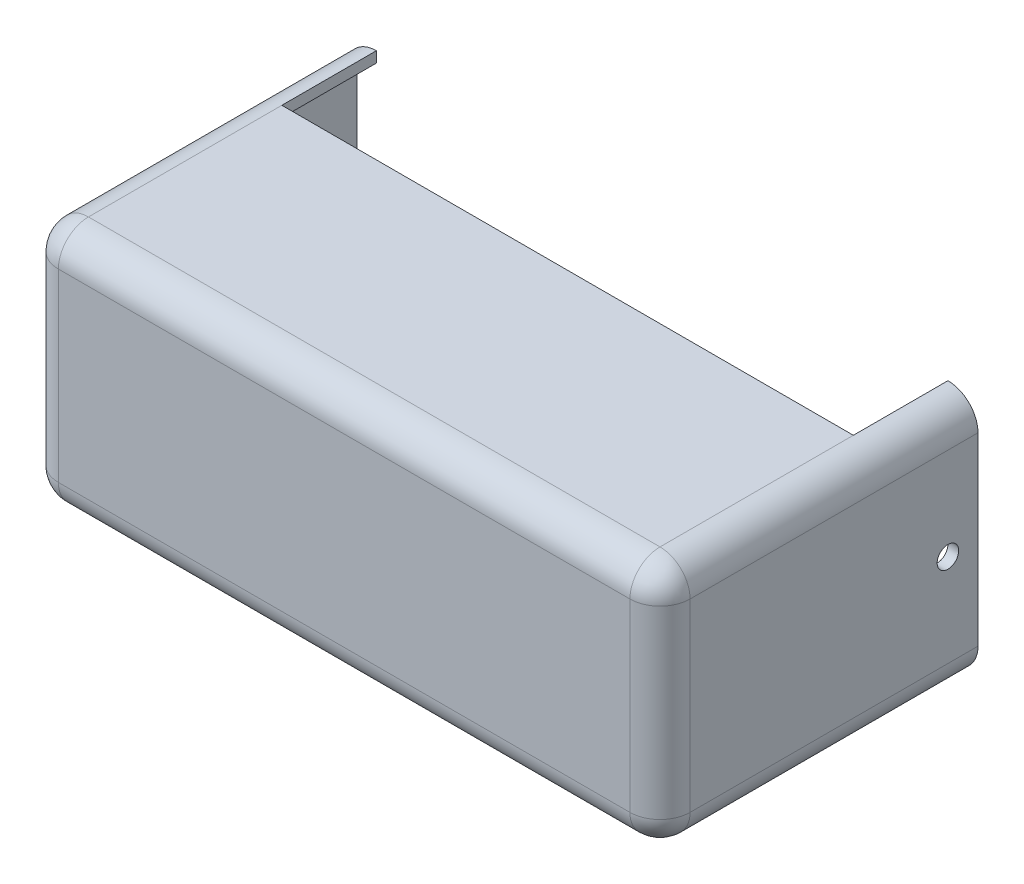
from build123d import *

# Parameters (mm, degrees)
SKETCH1_W           = 132.08
SKETCH1_H           = 144.78
BOSS_EXTRUDE1_DEPTH = 373.38
FILLET1_R           = 17.78
SHELL1_T            = -6.35
SKETCH2_W           = 6.35
SKETCH2_H           = 109.22
BOSS_EXTRUDE2_DEPTH = 55.88
SKETCH3_R           = 6.35
CUT_EXTRUDE1_DEPTH  = 383.54


with BuildPart() as part:
    # Sketch1 → Boss-Extrude1 (new body)
    with BuildSketch(Plane(origin=(0, 0, 0), x_dir=(0, 0, -1), z_dir=(1, 0, 0))):
        with Locations((66.04, 72.39)):
            Rectangle(SKETCH1_W, SKETCH1_H)
    extrude(amount=BOSS_EXTRUDE1_DEPTH)

    # Fillet1
    fillet1_edges = [part.edges().sort_by_distance(p)[0] for p in [
        (373.38, 144.78, -66.04),
        (373.38, 72.39, 0),
        (0, 144.78, -66.04),
        (0, 0, -66.04),
        (0, 72.39, 0),
        (186.69, 144.78, 0),
        (186.69, 0, 0),
        (373.38, 0, -66.04),
    ]]
    fillet(fillet1_edges, radius=FILLET1_R)

    # Shell1
    shell1_openings = [part.faces().sort_by_distance(p)[0] for p in [
        (186.69, 72.39, -132.08),
    ]]
    offset(amount=SHELL1_T, openings=shell1_openings, kind=Kind.INTERSECTION)

    # Sketch2 → Boss-Extrude2 (add)
    with BuildSketch(Plane(origin=(0, 0, -132.08), x_dir=(-1, 0, 0), z_dir=(0, 0, -1))):
        with BuildLine():
            Line((-355.6, 144.78), (-355.6, 138.43))
            ThreePointArc((-355.6, 138.43), (-363.682230509, 135.082230509), (-367.03, 127))
            Line((-367.03, 127), (-373.38, 127))
            ThreePointArc((-373.38, 127), (-368.172358569, 139.572358569), (-355.6, 144.78))
        make_face()
        with Locations((-370.205, 72.39)):
            Rectangle(SKETCH2_W, SKETCH2_H)
        with BuildLine():
            Line((-355.6, 6.35), (-355.6, 0))
            ThreePointArc((-355.6, 0), (-368.172358569, 5.207641431), (-373.38, 17.78))
            Line((-373.38, 17.78), (-367.03, 17.78))
            ThreePointArc((-367.03, 17.78), (-363.682230509, 9.697769491), (-355.6, 6.35))
        make_face()
        with BuildLine():
            Line((-17.78, 138.43), (-17.78, 144.78))
            ThreePointArc((-17.78, 144.78), (-5.207641431, 139.572358569), (0, 127))
            Line((0, 127), (-6.35, 127))
            ThreePointArc((-6.35, 127), (-9.697769491, 135.082230509), (-17.78, 138.43))
        make_face()
        with Locations((-3.175, 72.39)):
            Rectangle(SKETCH2_W, SKETCH2_H)
        with BuildLine():
            Line((-6.35, 17.78), (0, 17.78))
            ThreePointArc((0, 17.78), (-5.207641431, 5.207641431), (-17.78, 0))
            Line((-17.78, 0), (-17.78, 6.35))
            ThreePointArc((-17.78, 6.35), (-9.697769491, 9.697769491), (-6.35, 17.78))
        make_face()
    extrude(amount=BOSS_EXTRUDE2_DEPTH)

    # Sketch3 → Cut-Extrude1 (cut)
    with BuildSketch(Plane(origin=(373.38, 0, 0), x_dir=(0, 0, -1), z_dir=(1, 0, 0))):
        with Locations(Location((170.18, 72.39, 0), (0, 0, 180))):
            Circle(SKETCH3_R)
    extrude(amount=-CUT_EXTRUDE1_DEPTH, mode=Mode.SUBTRACT)


solid = part.part
